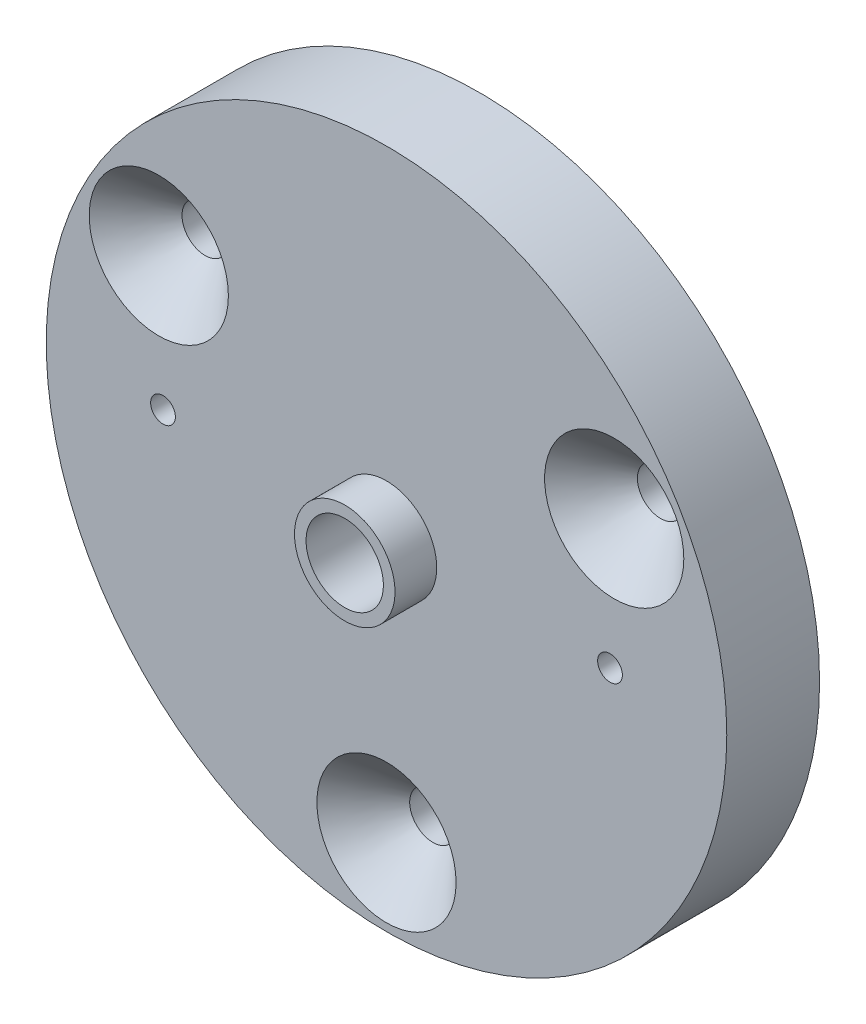
from build123d import *

# Parameters (mm, degrees)
SKETCH_1_R          = 22
EXTRUDE_1_DEPTH     = 6
SKETCH_2_R          = 3.25
EXTRUDE_2_DEPTH     = 2.7
SKETCH_3_R          = 2.5
CUT_EXTRUDE_1_DEPTH = 33.306191357
SKETCH_4_R          = 0.8
CUT_EXTRUDE_2_DEPTH = 32.685959036
SKETCH_5_R          = 13
CUT_EXTRUDE_3_DEPTH = 2
SKETCH_6_R          = 1.5
CUT_EXTRUDE_4_DEPTH = 32.685959036
CHAMFER_1_SIZE      = 3


with BuildPart() as part:
    # Эскиз1 → Бобышка-Вытянуть1 (new body)
    with BuildSketch(Plane.XY):
        Circle(SKETCH_1_R)
    extrude(amount=EXTRUDE_1_DEPTH)

    # Эскиз2 → Бобышка-Вытянуть2 (add)
    with BuildSketch(Plane.XY.offset(6)):
        with Locations(Location((0, 0, 0), (0, 0, 180))):
            Circle(SKETCH_2_R)
    extrude(amount=EXTRUDE_2_DEPTH)

    # Эскиз3 → Вырез-Вытянуть1 (cut, through all)
    with BuildSketch(Plane.XY.offset(8.7)):
        Circle(SKETCH_3_R)
    extrude(amount=-CUT_EXTRUDE_1_DEPTH, mode=Mode.SUBTRACT)

    # Эскиз4 → Вырез-Вытянуть2 (cut, through all)
    with BuildSketch(Plane.XY.offset(6)):
        with Locations((-14.45, 0)):
            Circle(SKETCH_4_R)
        with Locations((14.45, 0)):
            Circle(SKETCH_4_R)
    extrude(amount=-CUT_EXTRUDE_2_DEPTH, mode=Mode.SUBTRACT)

    # Эскиз5 → Вырез-Вытянуть3 (cut)
    with BuildSketch(Plane(origin=(0, 0, 0), x_dir=(-1, 0, 0), z_dir=(0, 0, -1))):
        Circle(SKETCH_5_R)
    extrude(amount=-CUT_EXTRUDE_3_DEPTH, mode=Mode.SUBTRACT)

    # Эскиз6 → Вырез-Вытянуть4 (cut, through all)
    with BuildSketch(Plane.XY.offset(6)):
        with Locations((0, -17)):
            Circle(SKETCH_6_R)
        with Locations((-14.722431864, 8.5)):
            Circle(SKETCH_6_R)
        with Locations((14.722431864, 8.5)):
            Circle(SKETCH_6_R)
    extrude(amount=-CUT_EXTRUDE_4_DEPTH, mode=Mode.SUBTRACT)

    # Фаска1
    chamfer_1_edges = [part.edges().sort_by_distance(p)[0] for p in [
        (-1.5, -17, 6),
        (-16.222431864, 8.5, 6),
        (13.222431864, 8.5, 6),
    ]]
    chamfer(chamfer_1_edges, length=CHAMFER_1_SIZE)


solid = part.part
